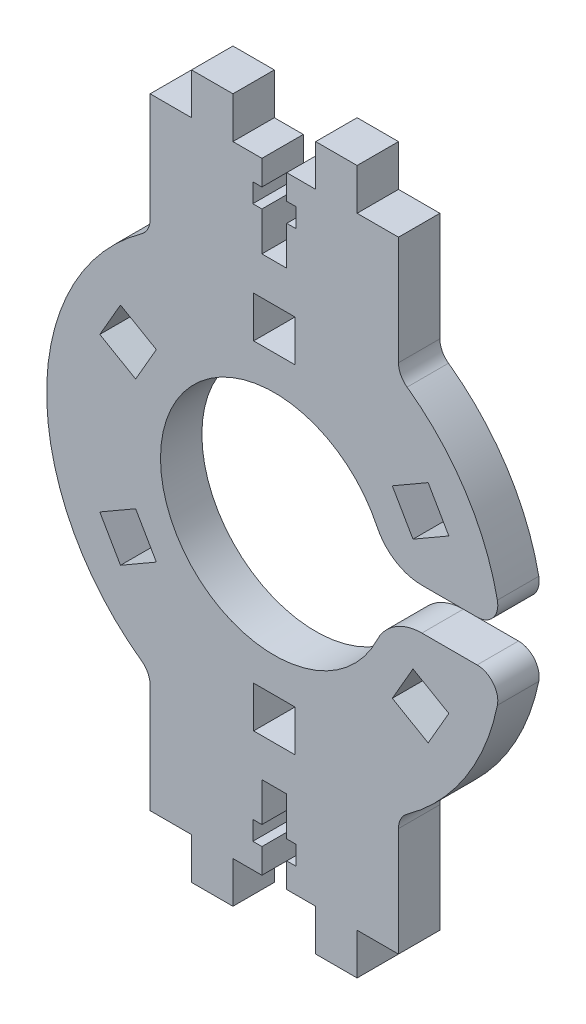
from build123d import *

# Parameters (mm, degrees)
ESQUISSE1_W        = 5
ESQUISSE1_H        = 5
BOSS_EXTRU_1_DEPTH = 5


with BuildPart() as part:
    # Esquisse1 → Boss.-Extru.1 (new body)
    with BuildSketch(Plane.XY):
        with BuildLine():
            Line((0, 0), (-5, 0))
            Line((-5, 0), (-5, -5))
            Line((-5, -5), (-10, -5))
            Line((-10, -5), (-10, 0))
            Line((-10, 0), (-13.5, 0))
            Line((-13.5, 0), (-13.5, 3))
            Line((-13.5, 3), (-12.4, 3))
            Line((-12.4, 3), (-12.4, 5.3))
            Line((-12.4, 5.3), (-13.5, 5.3))
            Line((-13.5, 5.3), (-13.5, 10))
            Line((-13.5, 10), (-16.5, 10))
            Line((-16.5, 10), (-16.5, 5.3))
            Line((-16.5, 5.3), (-17.6, 5.3))
            Line((-17.6, 5.3), (-17.6, 3))
            Line((-17.6, 3), (-16.5, 3))
            Line((-16.5, 3), (-16.5, 0))
            Line((-16.5, 0), (-20, 0))
            Line((-20, 0), (-20, -5))
            Line((-20, -5), (-25, -5))
            Line((-25, -5), (-25, 0))
            Line((-25, 0), (-30, 0))
            Line((-30, 0), (-30, 13.133014138))
            ThreePointArc((-30, 13.133014138), (-30.275608697, 14.274102799), (-31.041666667, 15.163596293))
            ThreePointArc((-31.041666667, 15.163596293), (-42.5, 37.5), (-31.041666667, 59.836403707))
            ThreePointArc((-31.041666667, 59.836403707), (-30.275608697, 60.725897201), (-30, 61.866985862))
            Line((-30, 61.866985862), (-30, 75))
            Line((-30, 75), (-25, 75))
            Line((-25, 75), (-25, 80))
            Line((-25, 80), (-20, 80))
            Line((-20, 80), (-20, 75))
            Line((-20, 75), (-16.5, 75))
            Line((-16.5, 75), (-16.5, 72))
            Line((-16.5, 72), (-17.6, 72))
            Line((-17.6, 72), (-17.6, 69.7))
            Line((-17.6, 69.7), (-16.5, 69.7))
            Line((-16.5, 69.7), (-16.5, 65))
            Line((-16.5, 65), (-13.5, 65))
            Line((-13.5, 65), (-13.5, 69.7))
            Line((-13.5, 69.7), (-12.4, 69.7))
            Line((-12.4, 69.7), (-12.4, 72))
            Line((-12.4, 72), (-13.5, 72))
            Line((-13.5, 72), (-13.5, 75))
            Line((-13.5, 75), (-10, 75))
            Line((-10, 75), (-10, 80))
            Line((-10, 80), (-5, 80))
            Line((-5, 80), (-5, 75))
            Line((-5, 75), (0, 75))
            Line((0, 75), (0, 61.866985862))
            ThreePointArc((0, 61.866985862), (0.275608697, 60.725897201), (1.041666667, 59.836403707))
            ThreePointArc((1.041666667, 59.836403707), (8.082814572, 52.447697864), (11.944387171, 43))
            ThreePointArc((11.944387171, 43), (11.431389101, 40.91886117), (9.494897428, 40))
            Line((9.494897428, 40), (2.827296486, 40))
            ThreePointArc((2.827296486, 40), (-0.374759815, 40.92586604), (-2.588591054, 43.417721519))
            ThreePointArc((-2.588591054, 43.417721519), (-28.75, 37.5), (-2.588591054, 31.582278481))
            ThreePointArc((-2.588591054, 31.582278481), (-0.374759815, 34.07413396), (2.827296486, 35))
            Line((2.827296486, 35), (9.494897428, 35))
            ThreePointArc((9.494897428, 35), (11.431389101, 34.08113883), (11.944387171, 32))
            ThreePointArc((11.944387171, 32), (8.082814572, 22.552302136), (1.041666667, 15.163596293))
            ThreePointArc((1.041666667, 15.163596293), (0.275608697, 14.274102799), (0, 13.133014138))
            Line((0, 13.133014138), (0, 0))
        make_face()
        with Locations((-15, 57.9)):
            Rectangle(ESQUISSE1_W, ESQUISSE1_H, mode=Mode.SUBTRACT)
        Polygon((3.581981747, 51.115063509), (6.081981747, 46.784936491), (1.751854728, 44.284936491), (-0.748145272, 48.615063509), align=None, mode=Mode.SUBTRACT)
        Polygon((6.081981747, 28.215063509), (3.581981747, 23.884936491), (-0.748145272, 26.384936491), (1.751854728, 30.715063509), align=None, mode=Mode.SUBTRACT)
        with Locations((-15, 17.1)):
            Rectangle(ESQUISSE1_W, ESQUISSE1_H, mode=Mode.SUBTRACT)
        Polygon((-33.581981747, 23.884936491), (-36.081981747, 28.215063509), (-31.751854728, 30.715063509), (-29.251854728, 26.384936491), align=None, mode=Mode.SUBTRACT)
        Polygon((-36.081981747, 46.784936491), (-33.581981747, 51.115063509), (-29.251854728, 48.615063509), (-31.751854728, 44.284936491), align=None, mode=Mode.SUBTRACT)
    extrude(amount=BOSS_EXTRU_1_DEPTH)


solid = part.part
